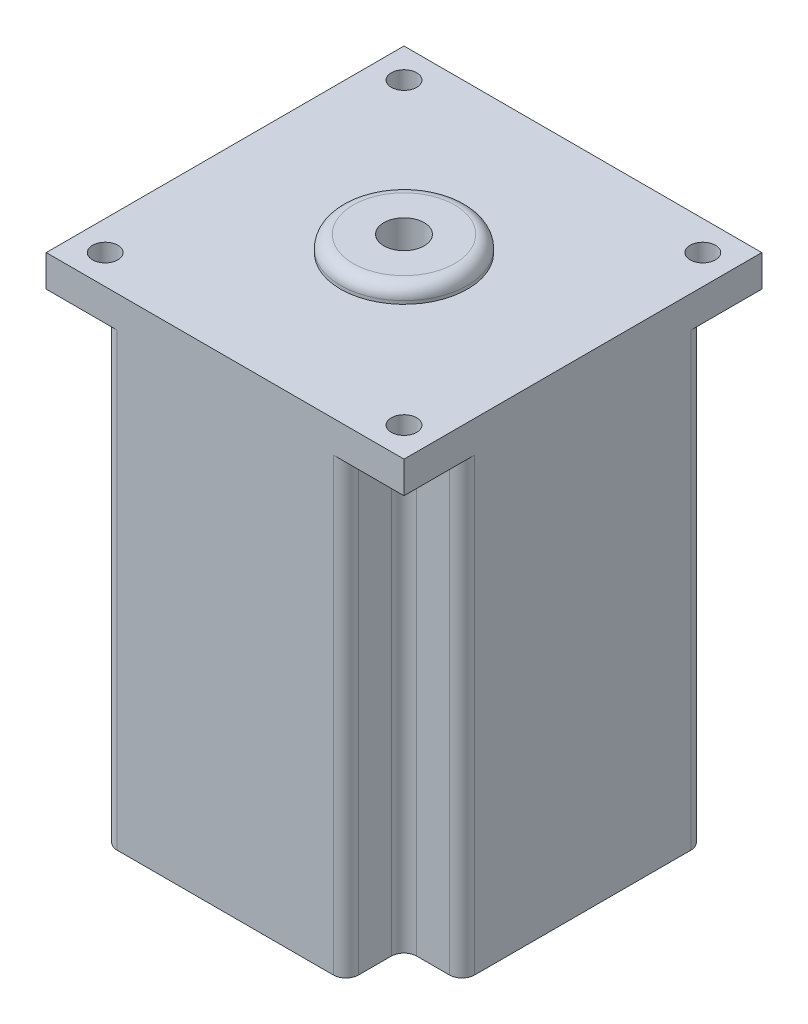
from build123d import *

# Parameters (mm, degrees)
SKETCH2_W           = 56.4
SKETCH2_H           = 56.4
BOSS_EXTRUDE1_DEPTH = 76
SKETCH3_R           = 3.175
CUT_EXTRUDE1_DEPTH  = 76
CUT_EXTRUDE2_START  = -71
SKETCH5_R           = 2
CUT_EXTRUDE2_DEPTH  = 71
FILLET1_R           = 2
BOSS_EXTRUDE2_START = 2.5
SKETCH6_R           = 10
SKETCH6_R_2         = 3.175
BOSS_EXTRUDE2_DEPTH = 2.5
FILLET2_R           = 2


with BuildPart() as part:
    # Sketch2 → Boss-Extrude1 (new body)
    with BuildSketch(Plane(origin=(0, 0, 0), x_dir=(1, 0, 0), z_dir=(0, 1, 0))):
        Rectangle(SKETCH2_W, SKETCH2_H)
    extrude(amount=BOSS_EXTRUDE1_DEPTH)

    # Sketch3 → Cut-Extrude1 (cut)
    with BuildSketch(Plane(origin=(0, 76, 0), x_dir=(1, 0, 0), z_dir=(0, 1, 0))):
        with BuildLine():
            Line((-23.55, 21.55), (-23.55, 23.55))
            Line((-23.55, 23.55), (-21.55, 23.55))
            ThreePointArc((-21.55, 23.55), (-24.964213562, 24.964213562), (-23.55, 21.55))
        make_face()
        with BuildLine():
            Line((-21.55, 23.55), (-23.55, 23.55))
            Line((-23.55, 23.55), (-23.55, 21.55))
            ThreePointArc((-23.55, 21.55), (-22.135786438, 22.135786438), (-21.55, 23.55))
        make_face()
        with BuildLine():
            ThreePointArc((25.55, 23.55), (23.55, 25.55), (21.55, 23.55))
            Line((21.55, 23.55), (23.55, 23.55))
            Line((23.55, 23.55), (23.55, 21.55))
            ThreePointArc((23.55, 21.55), (24.964213562, 22.135786438), (25.55, 23.55))
        make_face()
        with BuildLine():
            Line((23.55, 23.55), (21.55, 23.55))
            ThreePointArc((21.55, 23.55), (22.135786438, 22.135786438), (23.55, 21.55))
            Line((23.55, 21.55), (23.55, 23.55))
        make_face()
        with Locations(Location((0, 0, 0), (0, 0, 270))):
            Circle(SKETCH3_R)
        with BuildLine():
            ThreePointArc((-21.55, -23.55), (-22.135786438, -22.135786438), (-23.55, -21.55))
            Line((-23.55, -21.55), (-23.55, -23.55))
            Line((-23.55, -23.55), (-21.55, -23.55))
        make_face()
        with BuildLine():
            Line((-23.55, -23.55), (-23.55, -21.55))
            ThreePointArc((-23.55, -21.55), (-24.964213562, -24.964213562), (-21.55, -23.55))
            Line((-21.55, -23.55), (-23.55, -23.55))
        make_face()
        with BuildLine():
            ThreePointArc((25.55, -23.55), (24.964213562, -22.135786438), (23.55, -21.55))
            Line((23.55, -21.55), (23.55, -23.55))
            Line((23.55, -23.55), (21.55, -23.55))
            ThreePointArc((21.55, -23.55), (23.55, -25.55), (25.55, -23.55))
        make_face()
        with BuildLine():
            Line((23.55, -23.55), (23.55, -21.55))
            ThreePointArc((23.55, -21.55), (22.135786438, -22.135786438), (21.55, -23.55))
            Line((21.55, -23.55), (23.55, -23.55))
        make_face()
    extrude(amount=-CUT_EXTRUDE1_DEPTH, mode=Mode.SUBTRACT)

    # Sketch5 → Cut-Extrude2 (cut)
    # profile 1 of 4: a face of its own
    with BuildSketch(Plane(origin=(0, 0, 0), x_dir=(-1, 0, 0), z_dir=(0, -1, 0)).offset(CUT_EXTRUDE2_START)):
        with BuildLine():
            Line((19.05, 28.2), (19.05, 21.05))
            ThreePointArc((19.05, 21.05), (19.635786438, 19.635786438), (21.05, 19.05))
            Line((21.05, 19.05), (28.2, 19.05))
            Line((28.2, 19.05), (28.2, 28.2))
            Line((28.2, 28.2), (19.05, 28.2))
        make_face()
        with Locations((23.55, 23.55)):
            Circle(SKETCH5_R, mode=Mode.SUBTRACT)
    # profile 2 of 4: a face of its own
    with BuildSketch(Plane(origin=(0, 0, 0), x_dir=(-1, 0, 0), z_dir=(0, -1, 0)).offset(CUT_EXTRUDE2_START)):
        with BuildLine():
            Line((-19.05, 21.05), (-19.05, 28.2))
            Line((-19.05, 28.2), (-28.2, 28.2))
            Line((-28.2, 28.2), (-28.2, 19.05))
            Line((-28.2, 19.05), (-21.05, 19.05))
            ThreePointArc((-21.05, 19.05), (-19.635786438, 19.635786438), (-19.05, 21.05))
        make_face()
        with Locations((-23.55, 23.55)):
            Circle(SKETCH5_R, mode=Mode.SUBTRACT)
    # profile 3 of 4: a face of its own
    with BuildSketch(Plane(origin=(0, 0, 0), x_dir=(-1, 0, 0), z_dir=(0, -1, 0)).offset(CUT_EXTRUDE2_START)):
        with BuildLine():
            Line((28.2, -28.2), (28.2, -19.05))
            Line((28.2, -19.05), (21.05, -19.05))
            ThreePointArc((21.05, -19.05), (19.635786438, -19.635786438), (19.05, -21.05))
            Line((19.05, -21.05), (19.05, -28.2))
            Line((19.05, -28.2), (28.2, -28.2))
        make_face()
        with Locations((23.55, -23.55)):
            Circle(SKETCH5_R, mode=Mode.SUBTRACT)
    # profile 4 of 4: a face of its own
    with BuildSketch(Plane(origin=(0, 0, 0), x_dir=(-1, 0, 0), z_dir=(0, -1, 0)).offset(CUT_EXTRUDE2_START)):
        with BuildLine():
            Line((-21.05, -19.05), (-28.2, -19.05))
            Line((-28.2, -19.05), (-28.2, -28.2))
            Line((-28.2, -28.2), (-19.05, -28.2))
            Line((-19.05, -28.2), (-19.05, -21.05))
            ThreePointArc((-19.05, -21.05), (-19.635786438, -19.635786438), (-21.05, -19.05))
        make_face()
        with Locations((-23.55, -23.55)):
            Circle(SKETCH5_R, mode=Mode.SUBTRACT)
    extrude(amount=CUT_EXTRUDE2_DEPTH, mode=Mode.SUBTRACT)

    # Fillet1
    fillet1_edges = [part.edges().sort_by_distance(p)[0] for p in [
        (-19.05, 35.5, -28.2),
        (-28.2, 35.5, -19.05),
        (28.2, 35.5, -19.05),
        (19.05, 35.5, -28.2),
        (19.05, 35.5, 28.2),
        (28.2, 35.5, 19.05),
        (-28.2, 35.5, 19.05),
        (-19.05, 35.5, 28.2),
    ]]
    fillet(fillet1_edges, radius=FILLET1_R)

    # Sketch6 → Boss-Extrude2 (add)
    with BuildSketch(Plane(origin=(0, 76, 0), x_dir=(1, 0, 0), z_dir=(0, 1, 0)).offset(BOSS_EXTRUDE2_START)):
        with Locations(Location((0, 0, 0), (0, 0, 270))):
            Circle(SKETCH6_R)
        with Locations(Location((0, 0, 0), (0, 0, 270))):
            Circle(SKETCH6_R_2, mode=Mode.SUBTRACT)
    extrude(amount=-BOSS_EXTRUDE2_DEPTH)

    # Fillet2
    fillet2_edges = [part.edges().sort_by_distance(p)[0] for p in [
        (0, 78.5, -10),
    ]]
    fillet(fillet2_edges, radius=FILLET2_R)


solid = part.part
